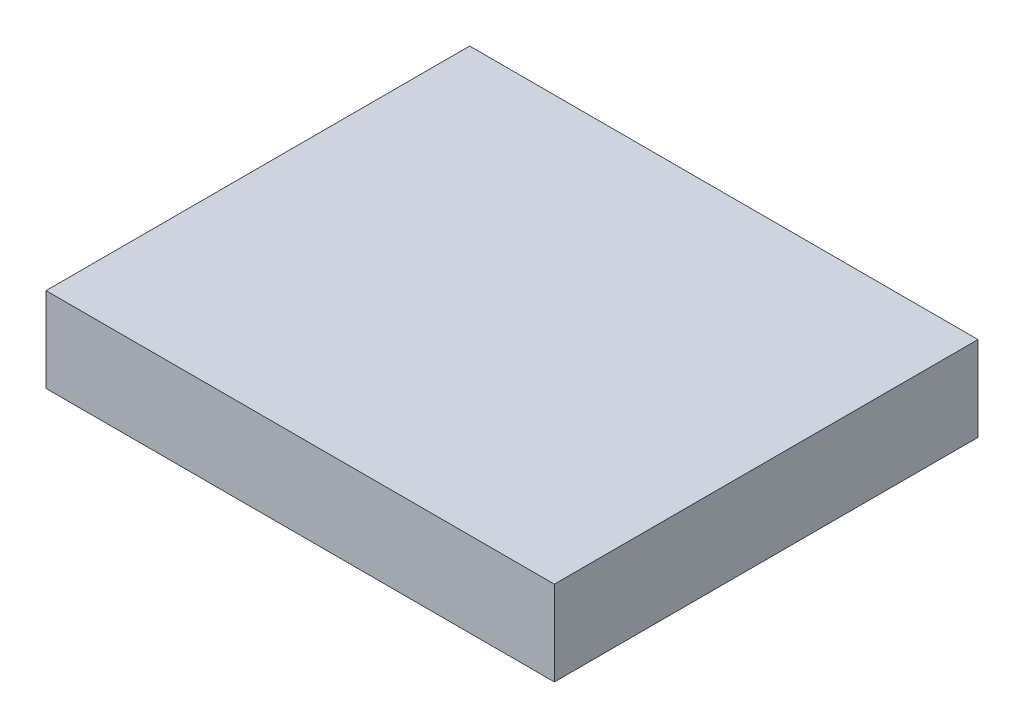
from build123d import *

# Parameters (mm, degrees)
SKETCH2_W           = 38.1
SKETCH2_H           = 31.75
BOSS_EXTRUDE1_DEPTH = 6.35


with BuildPart() as part:
    # Sketch2 → Boss-Extrude1 (new body)
    with BuildSketch(Plane(origin=(0, 0, 0), x_dir=(1, 0, 0), z_dir=(0, 1, 0))):
        with Locations((19.05, 15.875)):
            Rectangle(SKETCH2_W, SKETCH2_H)
    extrude(amount=BOSS_EXTRUDE1_DEPTH)


solid = part.part
